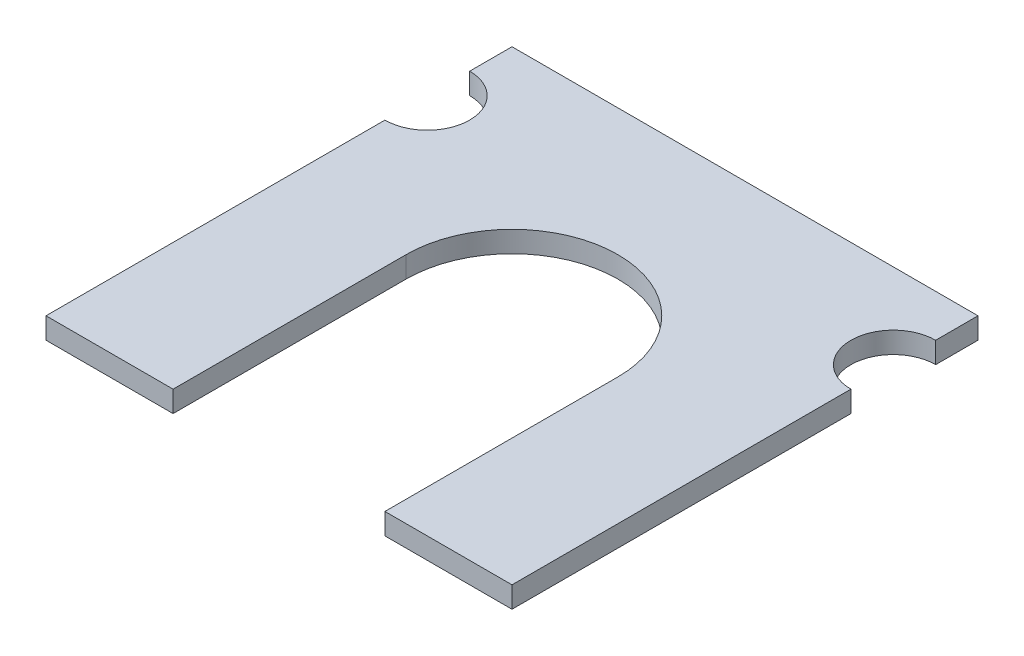
from build123d import *

# Parameters (mm, degrees)
BOSS_EXTRUDE1_DEPTH = 0.5


with BuildPart() as part:
    # Sketch1 → Boss-Extrude1 (new body)
    with BuildSketch(Plane(origin=(0, 0, 0), x_dir=(1, 0, 0), z_dir=(0, 1, 0))):
        with BuildLine():
            Line((-5.5, 5.5), (-5.5, 4.5))
            ThreePointArc((-5.5, 4.5), (-4.5, 3.5), (-5.5, 2.5))
            Line((-5.5, 2.5), (-5.5, -5.5))
            Line((-5.5, -5.5), (-2.5, -5.5))
            Line((-2.5, -5.5), (-2.5, 0))
            ThreePointArc((-2.5, 0), (0, 2.5), (2.5, 0))
            Line((2.5, 0), (2.5, -5.5))
            Line((2.5, -5.5), (5.5, -5.5))
            Line((5.5, -5.5), (5.5, 2.5))
            ThreePointArc((5.5, 2.5), (4.5, 3.5), (5.5, 4.5))
            Line((5.5, 4.5), (5.5, 5.5))
            Line((5.5, 5.5), (-5.5, 5.5))
        make_face()
    extrude(amount=BOSS_EXTRUDE1_DEPTH)


solid = part.part
